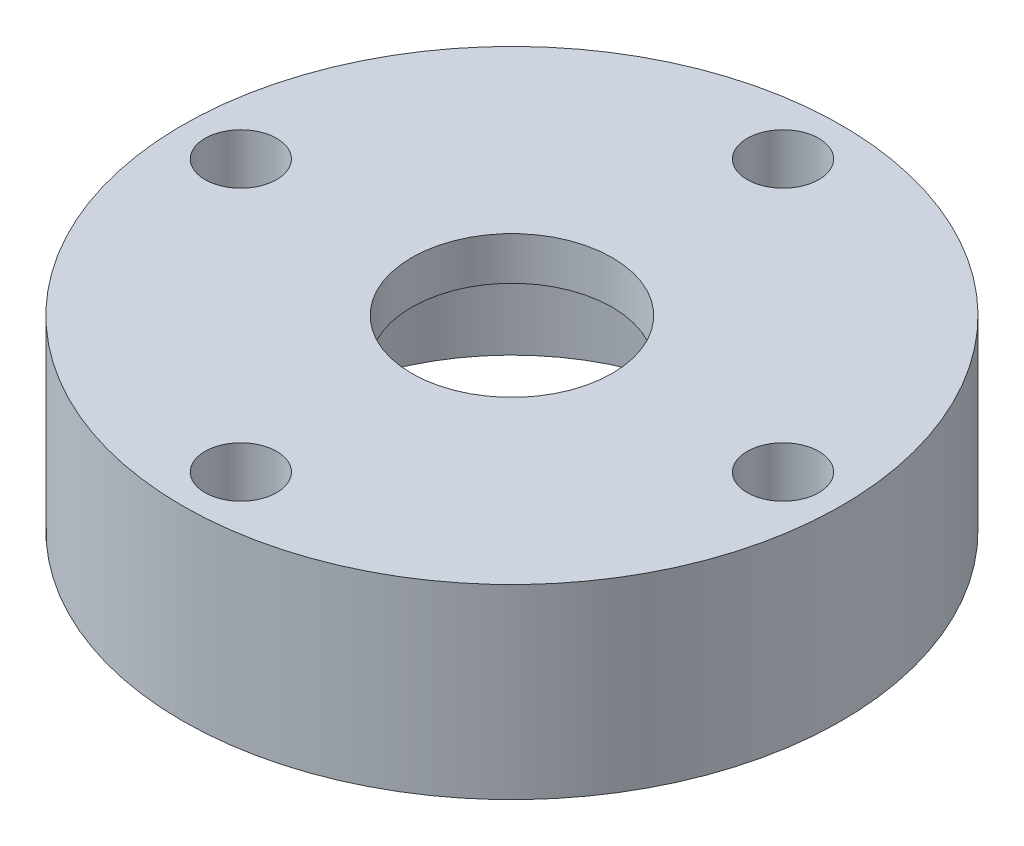
from build123d import *

# Parameters (mm, degrees)
SKETCH_1_R          = 11.5
SKETCH_1_R_2        = 7.5
EXTRUDE_1_DEPTH     = 5
SKETCH_2_R          = 11.5
EXTRUDE_3_DEPTH     = 1.5
SKETCH_3_R          = 1.25
CUT_EXTRUDE_4_DEPTH = 18.514279888
SKETCH_4_R          = 3.5
CUT_EXTRUDE_5_DEPTH = 18.514279888


with BuildPart() as part:
    # Эскиз1 → Вытянуть1 (new body)
    with BuildSketch(Plane(origin=(0, 0, 0), x_dir=(1, 0, 0), z_dir=(0, 1, 0))):
        with Locations(Location((0, 0, 0), (0, 0, 270))):
            Circle(SKETCH_1_R)
        with Locations(Location((0, 0, 0), (0, 0, 270))):
            Circle(SKETCH_1_R_2, mode=Mode.SUBTRACT)
    extrude(amount=EXTRUDE_1_DEPTH)

    # Эскиз2 → Вытянуть3 (add)
    with BuildSketch(Plane(origin=(0, 5, 0), x_dir=(1, 0, 0), z_dir=(0, 1, 0))):
        with Locations(Location((0, 0, 0), (0, 0, 270))):
            Circle(SKETCH_2_R)
    extrude(amount=EXTRUDE_3_DEPTH)

    # Эскиз3 → Вытянуть4 (cut, through all)
    with BuildSketch(Plane(origin=(0, 6.5, 0), x_dir=(-1, 0, 0), z_dir=(0, 1, 0))):
        with Locations(Location((0, -9.45968553, 0), (0, 0, 90))):
            Circle(SKETCH_3_R)
        with Locations(Location((-9.45968553, 0, 0), (0, 0, 90))):
            Circle(SKETCH_3_R)
        with Locations(Location((0, 9.45968553, 0), (0, 0, 90))):
            Circle(SKETCH_3_R)
        with Locations(Location((9.45968553, 0, 0), (0, 0, 90))):
            Circle(SKETCH_3_R)
    extrude(amount=-CUT_EXTRUDE_4_DEPTH, mode=Mode.SUBTRACT)

    # Эскиз4 → Вытянуть5 (cut, through all)
    with BuildSketch(Plane(origin=(0, 6.5, 0), x_dir=(-1, 0, 0), z_dir=(0, 1, 0))):
        with Locations(Location((0, 0, 0), (0, 0, 90))):
            Circle(SKETCH_4_R)
    extrude(amount=-CUT_EXTRUDE_5_DEPTH, mode=Mode.SUBTRACT)


solid = part.part
